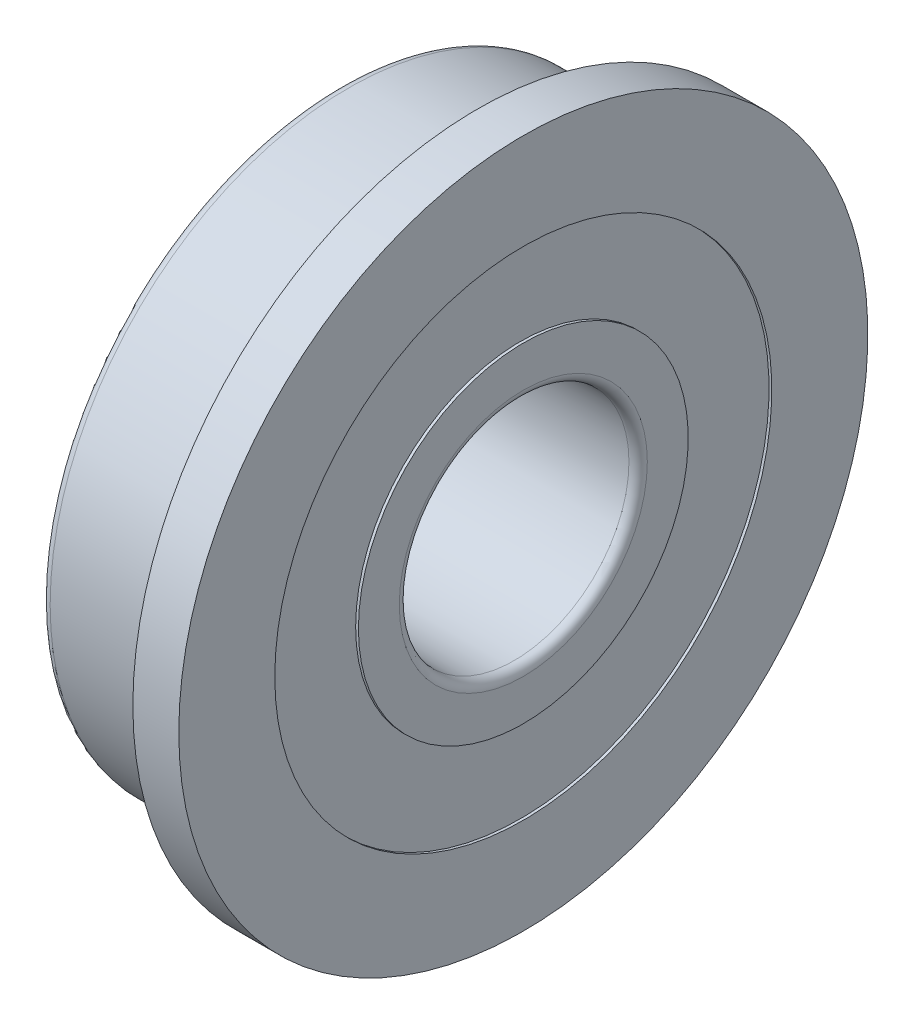
from build123d import *

# Parameters (mm, degrees)
PATTERN_CIRCULAR_1_COUNT = 11
SKETCH_5_W               = 0.3
SKETCH_5_H               = 1.82
SKETCH_6_W               = 0.24
SKETCH_6_H               = 1.82


with BuildPart() as part:
    # 草图2 → 旋转1 (revolve)
    with BuildSketch(Plane.XY, mode=Mode.PRIVATE) as revolve_1_sk:
        with BuildLine():
            Line((0.2, 6.5), (3, 6.5))
            Line((3, 6.5), (3, 7.5))
            Line((3, 7.5), (4, 7.5))
            Line((4, 7.5), (4, 2.7))
            ThreePointArc((4, 2.7), (3.941421356, 2.558578644), (3.8, 2.5))
            Line((3.8, 2.5), (0.2, 2.5))
            ThreePointArc((0.2, 2.5), (0.058578644, 2.558578644), (0, 2.7))
            Line((0, 2.7), (0, 6.3))
            ThreePointArc((0, 6.3), (0.058578644, 6.441421356), (0.2, 6.5))
        make_face()
    revolve(revolve_1_sk.sketch.rotate(Axis((0, 0, 0), (1, 0, 0)), 90), axis=Axis((0, 0, 0), (1, 0, 0)))

    # 草图3 → 切除-旋转1 (revolve, cut)
    with BuildSketch(Plane.XY, mode=Mode.PRIVATE) as cut_revolve_1_sk:
        with BuildLine():
            Line((2.714142843, 5.2), (4, 5.2))
            Line((4, 5.2), (4, 3.8))
            Line((4, 3.8), (2.714142843, 3.8))
            ThreePointArc((2.714142843, 3.8), (2, 3.5), (1.285857157, 3.8))
            Line((1.285857157, 3.8), (0, 3.8))
            Line((0, 3.8), (0, 5.2))
            Line((0, 5.2), (1.285857157, 5.2))
            ThreePointArc((1.285857157, 5.2), (2, 5.5), (2.714142843, 5.2))
        make_face()
    revolve(cut_revolve_1_sk.sketch.rotate(Axis((0, 0, 0), (-1, 0, 0)), 90), axis=Axis((0, 0, 0), (-1, 0, 0)), mode=Mode.SUBTRACT)


with BuildPart() as cut_revolve_1_piece_1:
    # of the separate pieces the step leaves, piece 1, a body of its own (cut_revolve_1_pieces)
    add(part.part.solids().sort_by_distance((0, 0, 6.3))[0])


with BuildPart() as cut_revolve_1_piece_2:
    # of the separate pieces the step leaves, piece 2, a body of its own (cut_revolve_1_pieces)
    add(part.part.solids().sort_by_distance((0, 0, -3.8))[0])


with BuildPart() as body_3:
    # 草图4 → 旋转2 (revolve)
    with BuildSketch(Plane.XY):
        with BuildLine():
            Line((1, 4.5), (3, 4.5))
            ThreePointArc((3, 4.5), (2, 5.5), (1, 4.5))
        make_face()
    revolve(axis=Axis((2, 4.5, 0), (1, 0, 0)))


with BuildPart() as pattern_circular_1_1:
    # 阵列(圆周)1: pattern copy
    add(body_3.part.rotate(Axis((0, 0, 0), (1, 0, 0)), 1 * 360 / PATTERN_CIRCULAR_1_COUNT))


with BuildPart() as pattern_circular_1_2:
    # 阵列(圆周)1: pattern copy
    add(body_3.part.rotate(Axis((0, 0, 0), (1, 0, 0)), 2 * 360 / PATTERN_CIRCULAR_1_COUNT))


with BuildPart() as pattern_circular_1_3:
    # 阵列(圆周)1: pattern copy
    add(body_3.part.rotate(Axis((0, 0, 0), (1, 0, 0)), 3 * 360 / PATTERN_CIRCULAR_1_COUNT))


with BuildPart() as pattern_circular_1_4:
    # 阵列(圆周)1: pattern copy
    add(body_3.part.rotate(Axis((0, 0, 0), (1, 0, 0)), 4 * 360 / PATTERN_CIRCULAR_1_COUNT))


with BuildPart() as pattern_circular_1_5:
    # 阵列(圆周)1: pattern copy
    add(body_3.part.rotate(Axis((0, 0, 0), (1, 0, 0)), 5 * 360 / PATTERN_CIRCULAR_1_COUNT))


with BuildPart() as pattern_circular_1_6:
    # 阵列(圆周)1: pattern copy
    add(body_3.part.rotate(Axis((0, 0, 0), (1, 0, 0)), 6 * 360 / PATTERN_CIRCULAR_1_COUNT))


with BuildPart() as pattern_circular_1_7:
    # 阵列(圆周)1: pattern copy
    add(body_3.part.rotate(Axis((0, 0, 0), (1, 0, 0)), 7 * 360 / PATTERN_CIRCULAR_1_COUNT))


with BuildPart() as pattern_circular_1_8:
    # 阵列(圆周)1: pattern copy
    add(body_3.part.rotate(Axis((0, 0, 0), (1, 0, 0)), 8 * 360 / PATTERN_CIRCULAR_1_COUNT))


with BuildPart() as pattern_circular_1_9:
    # 阵列(圆周)1: pattern copy
    add(body_3.part.rotate(Axis((0, 0, 0), (1, 0, 0)), 9 * 360 / PATTERN_CIRCULAR_1_COUNT))


with BuildPart() as pattern_circular_1_10:
    # 阵列(圆周)1: pattern copy
    add(body_3.part.rotate(Axis((0, 0, 0), (1, 0, 0)), 10 * 360 / PATTERN_CIRCULAR_1_COUNT))


with BuildPart() as cut_revolve_2_tool:
    # 草图5 → 切除-旋转2 (revolve)
    with BuildSketch(Plane.XY):
        with Locations((3.85, 4.5)):
            Rectangle(SKETCH_5_W, SKETCH_5_H)
        with Locations((0.15, 4.5)):
            Rectangle(SKETCH_5_W, SKETCH_5_H)
    revolve(axis=Axis((0, 0, 0), (1, 0, 0)))


with BuildPart() as cut_revolve_1_piece_1_1:
    add(cut_revolve_1_piece_1.part)

    # 切除-旋转2: cut by cut_revolve_2_tool
    add(cut_revolve_2_tool.part, mode=Mode.SUBTRACT)


with BuildPart() as cut_revolve_1_piece_2_1:
    add(cut_revolve_1_piece_2.part)

    # 切除-旋转2: cut by cut_revolve_2_tool
    add(cut_revolve_2_tool.part, mode=Mode.SUBTRACT)


with BuildPart() as body_14:
    # 草图6 → 旋转3 (revolve)
    with BuildSketch(Plane.XY, mode=Mode.PRIVATE) as revolve_3_sk:
        with Locations((3.82, 4.5)):
            Rectangle(SKETCH_6_W, SKETCH_6_H)
        with Locations((0.18, 4.5)):
            Rectangle(SKETCH_6_W, SKETCH_6_H)
    revolve(revolve_3_sk.sketch.rotate(Axis((0, 0, 0), (1, 0, 0)), 90), axis=Axis((0, 0, 0), (1, 0, 0)))


solid = Compound([body_3.part, pattern_circular_1_1.part, pattern_circular_1_2.part, pattern_circular_1_3.part, pattern_circular_1_4.part, pattern_circular_1_5.part, pattern_circular_1_6.part, pattern_circular_1_7.part, pattern_circular_1_8.part, pattern_circular_1_9.part, pattern_circular_1_10.part, cut_revolve_1_piece_1_1.part, cut_revolve_1_piece_2_1.part, body_14.part])
